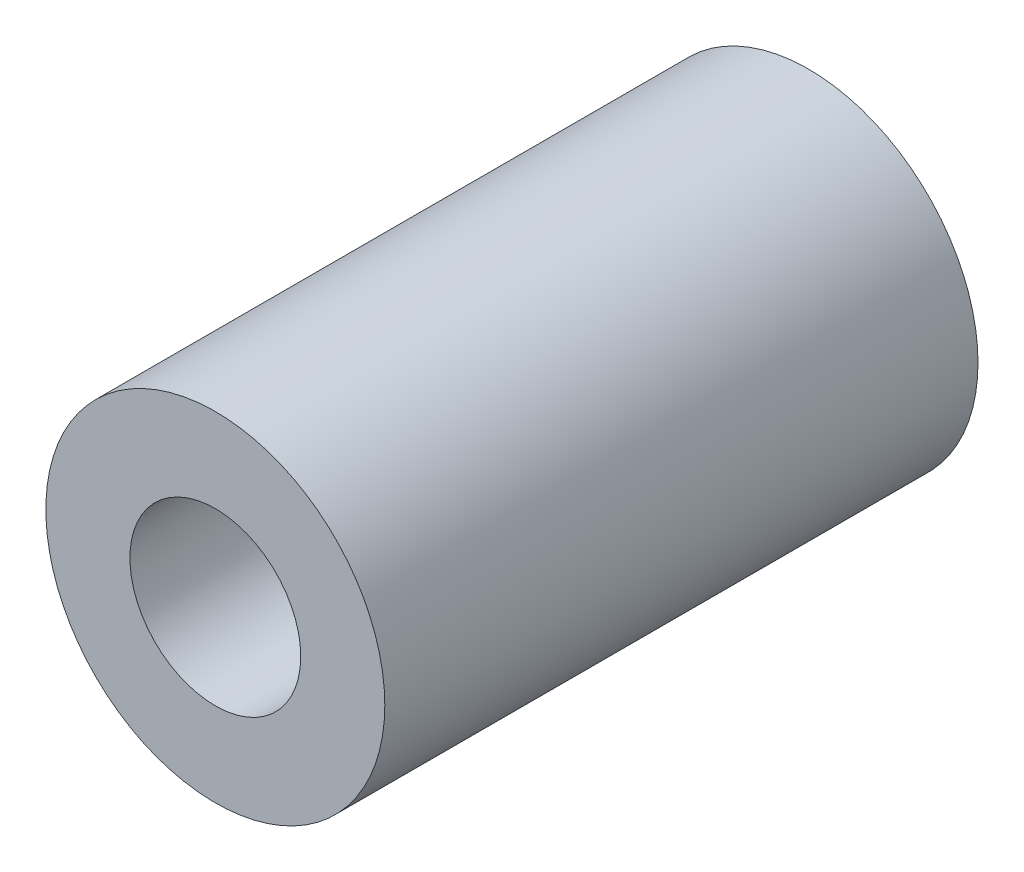
from build123d import *

# Parameters (mm, degrees)
SKETCH2_R           = 6.35
SKETCH2_R_2         = 3.2004
BOSS_EXTRUDE1_DEPTH = 11.1125


with BuildPart() as part:
    # Sketch2 → Boss-Extrude1 (new, symmetric)
    with BuildSketch(Plane.XY):
        Circle(SKETCH2_R)
        Circle(SKETCH2_R_2, mode=Mode.SUBTRACT)
    extrude(amount=BOSS_EXTRUDE1_DEPTH, both=True)


solid = part.part
